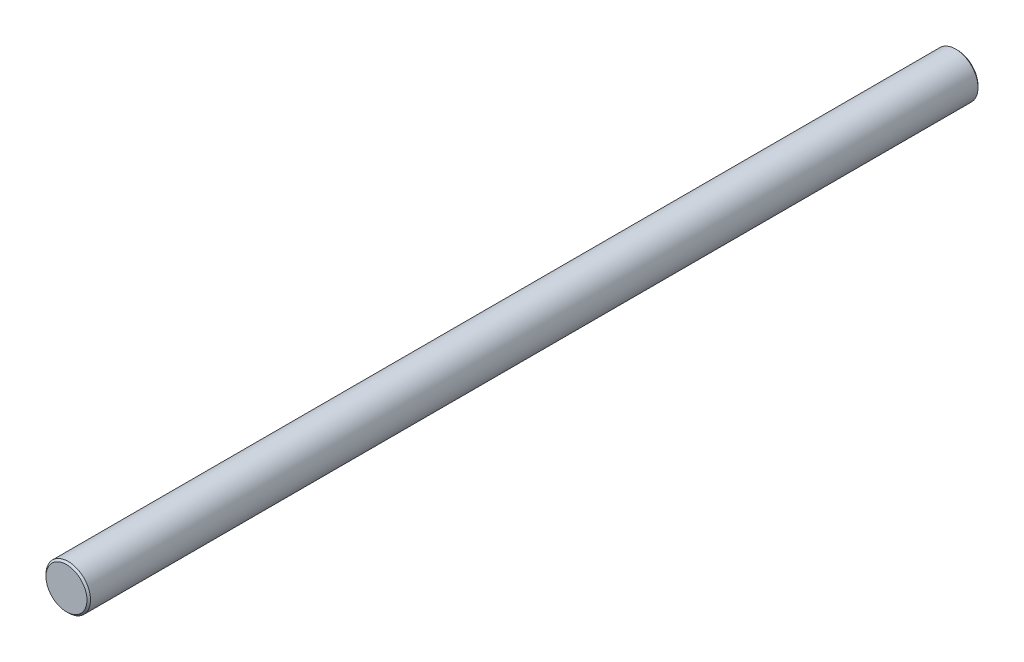
from build123d import *

# Parameters (mm, degrees)
SKETCH_1_R      = 12.5
EXTRUDE_1_DEPTH = 250
CHAMFER_1_SIZE  = 1


with BuildPart() as part:
    # Эскиз1 → Бобышка-Вытянуть1 (new, symmetric)
    with BuildSketch(Plane.XY):
        Circle(SKETCH_1_R)
    extrude(amount=EXTRUDE_1_DEPTH, both=True)

    # Фаска1
    chamfer_1_edges = [part.edges().sort_by_distance(p)[0] for p in [
        (-12.5, 0, -250),
        (-12.5, 0, 250),
    ]]
    chamfer(chamfer_1_edges, length=CHAMFER_1_SIZE)


solid = part.part
